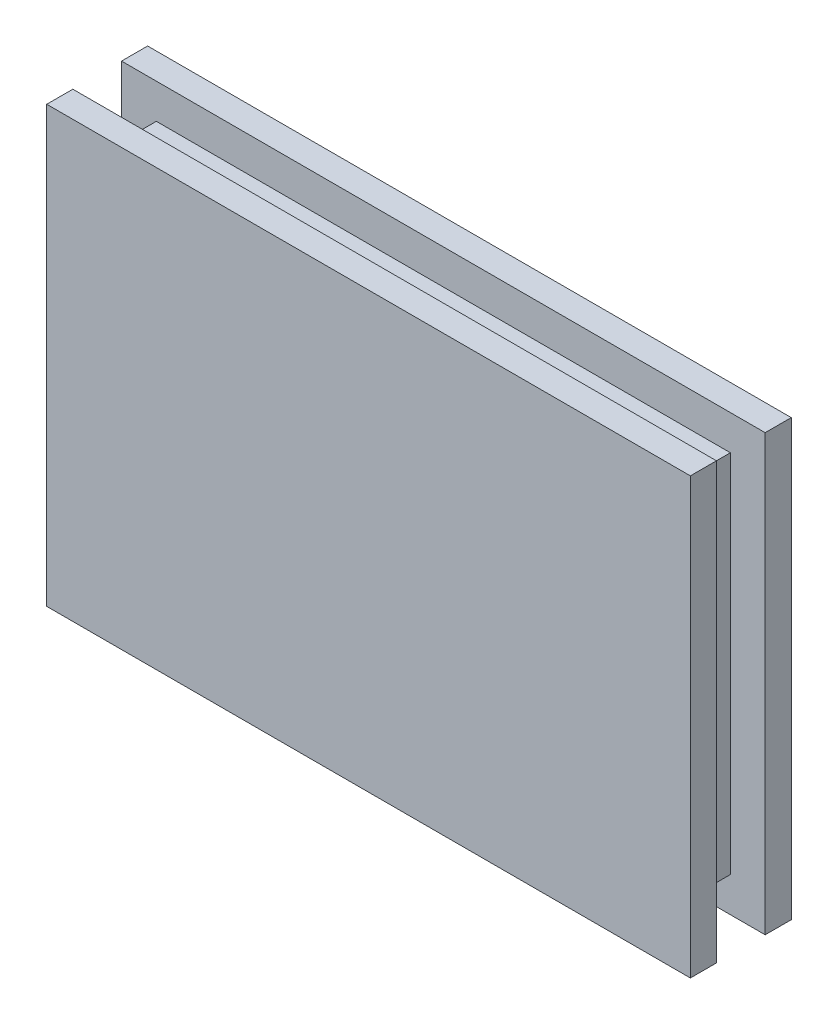
from build123d import *

# Parameters (mm, degrees)
CROQUIS1_W              = 37
CROQUIS1_H              = 25
SALIENTE_EXTRUIR1_DEPTH = 1.5
CROQUIS2_W              = 33
CROQUIS2_H              = 21
SALIENTE_EXTRUIR2_DEPTH = 2.8
SALIENTE_EXTRUIR3_START = 4.3
CROQUIS1_2_W            = 37
CROQUIS1_2_H            = 25
SALIENTE_EXTRUIR3_DEPTH = 1.5


with BuildPart() as part:
    # Croquis1 → Saliente-Extruir1 (new body)
    with BuildSketch(Plane.XY):
        Rectangle(CROQUIS1_W, CROQUIS1_H)
    extrude(amount=SALIENTE_EXTRUIR1_DEPTH)

    # Croquis2 → Saliente-Extruir2 (add)
    with BuildSketch(Plane.XY.offset(1.5)):
        Rectangle(CROQUIS2_W, CROQUIS2_H)
    extrude(amount=SALIENTE_EXTRUIR2_DEPTH)

    # Croquis1<2> → Saliente-Extruir3 (add)
    with BuildSketch(Plane.XY.offset(SALIENTE_EXTRUIR3_START)):
        Rectangle(CROQUIS1_2_W, CROQUIS1_2_H)
    extrude(amount=SALIENTE_EXTRUIR3_DEPTH)


solid = part.part
